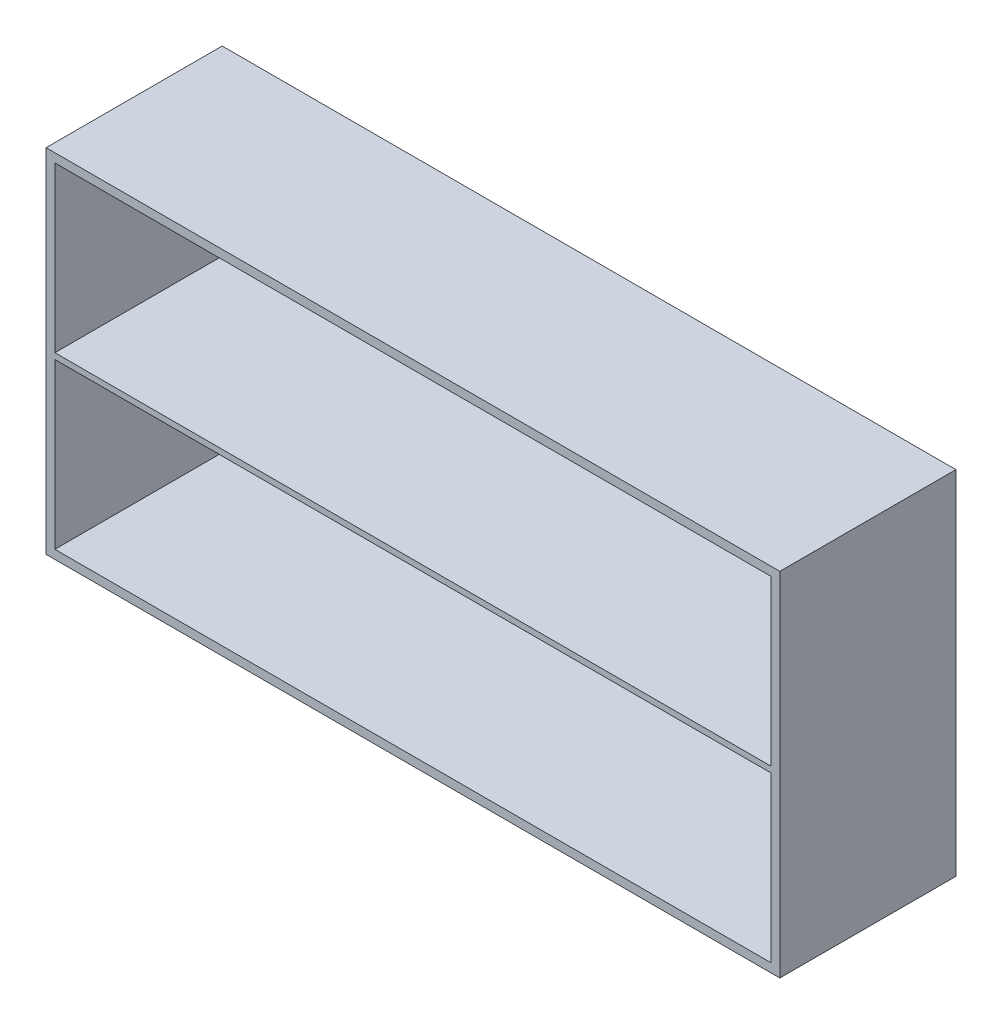
from build123d import *

# Parameters (mm, degrees)
SKETCH1_W           = 1250
SKETCH1_H           = 600
SKETCH1_W_2         = 1220
SKETCH1_H_2         = 570
SKETCH1_H_3         = 5
BOSS_EXTRUDE1_DEPTH = 300
SKETCH2_W           = 1250
SKETCH2_H           = 600
BOSS_EXTRUDE2_DEPTH = 5


with BuildPart() as part:
    # Sketch1 → Boss-Extrude1 (new body)
    # profile 1 of 3: a face of its own
    with BuildSketch(Plane.XY):
        with Locations((0, -300)):
            Rectangle(SKETCH1_W, SKETCH1_H)
        with Locations((0, -300)):
            Rectangle(SKETCH1_W_2, SKETCH1_H_2, mode=Mode.SUBTRACT)
    # profile 2 of 3: a face of its own
    with BuildSketch(Plane.XY):
        with Locations((0, -302.5)):
            Rectangle(SKETCH1_W_2, SKETCH1_H_3)
    # profile 3 of 3: a face of its own
    with BuildSketch(Plane.XY):
        with Locations((0, -297.5)):
            Rectangle(SKETCH1_W_2, SKETCH1_H_3)
    extrude(amount=BOSS_EXTRUDE1_DEPTH)

    # Sketch2 → Boss-Extrude2 (add)
    with BuildSketch(Plane(origin=(0, 0, 0), x_dir=(-1, 0, 0), z_dir=(0, 0, -1))):
        with Locations((0, -300)):
            Rectangle(SKETCH2_W, SKETCH2_H)
    extrude(amount=-BOSS_EXTRUDE2_DEPTH)


solid = part.part
